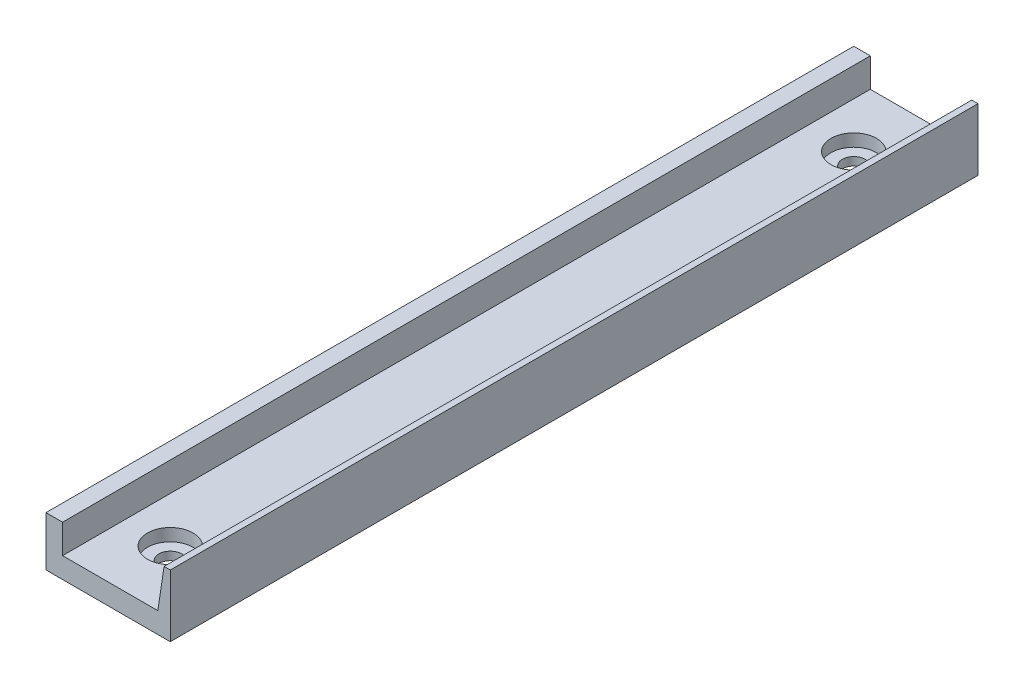
from build123d import *

# Parameters (mm, degrees)
SKETCH_1_W                   = 30
SKETCH_1_H                   = 195
EXTRUDE_1_DEPTH              = 5
SKETCH_2_W                   = 4
SKETCH_2_H                   = 195
SKETCH_2_W_2                 = 3
EXTRUDE_2_DEPTH              = 10
SKETCH_3_W                   = 4
SKETCH_3_H                   = 3
CUT_EXTRUDE_1_DEPTH          = 197.150452459
HOLE_WIZARD_M5_1_D           = 5.5
HOLE_WIZARD_M5_1_CBORE_D     = 11
HOLE_WIZARD_M5_1_CBORE_DEPTH = 3
SKETCH_7_W                   = 6.1
SKETCH_7_H                   = 120
EXTRUDE_3_DEPTH              = 6


with BuildPart() as part:
    # 스케치1 → 보스-돌출1 (new body)
    with BuildSketch(Plane(origin=(0, 0, 0), x_dir=(1, 0, 0), z_dir=(0, 1, 0))):
        Rectangle(SKETCH_1_W, SKETCH_1_H)
    extrude(amount=EXTRUDE_1_DEPTH)

    # 스케치2 → 보스-돌출2 (add)
    with BuildSketch(Plane(origin=(0, 5, 0), x_dir=(1, 0, 0), z_dir=(0, 1, 0))):
        with Locations((-13, 0)):
            Rectangle(SKETCH_2_W, SKETCH_2_H)
        with Locations((13.5, 0)):
            Rectangle(SKETCH_2_W_2, SKETCH_2_H)
    extrude(amount=EXTRUDE_2_DEPTH)

    # 스케치3 → 컷-돌출1 (cut, through all)
    with BuildSketch(Plane.XY.offset(97.5)):
        with Locations((-13, 13.5)):
            Rectangle(SKETCH_3_W, SKETCH_3_H)
        Polygon((12, 5), (12, 15), (13.5, 15), align=None)
    extrude(amount=-CUT_EXTRUDE_1_DEPTH, mode=Mode.SUBTRACT)

    # M5 소켓 머리 캡 나사용 카운터보어1 (through all)
    with Locations(Plane(origin=(0, 5, 0), x_dir=(1, 0, 0), z_dir=(0, 1, 0))):
        with Locations((0, -82.5), (0, 82.5)):
            CounterBoreHole(HOLE_WIZARD_M5_1_D / 2, HOLE_WIZARD_M5_1_CBORE_D / 2, HOLE_WIZARD_M5_1_CBORE_DEPTH)

    # 스케치7 → 보스-돌출3 (add)
    with BuildSketch(Plane.XZ):
        Rectangle(SKETCH_7_W, SKETCH_7_H)
    extrude(amount=EXTRUDE_3_DEPTH)


solid = part.part
